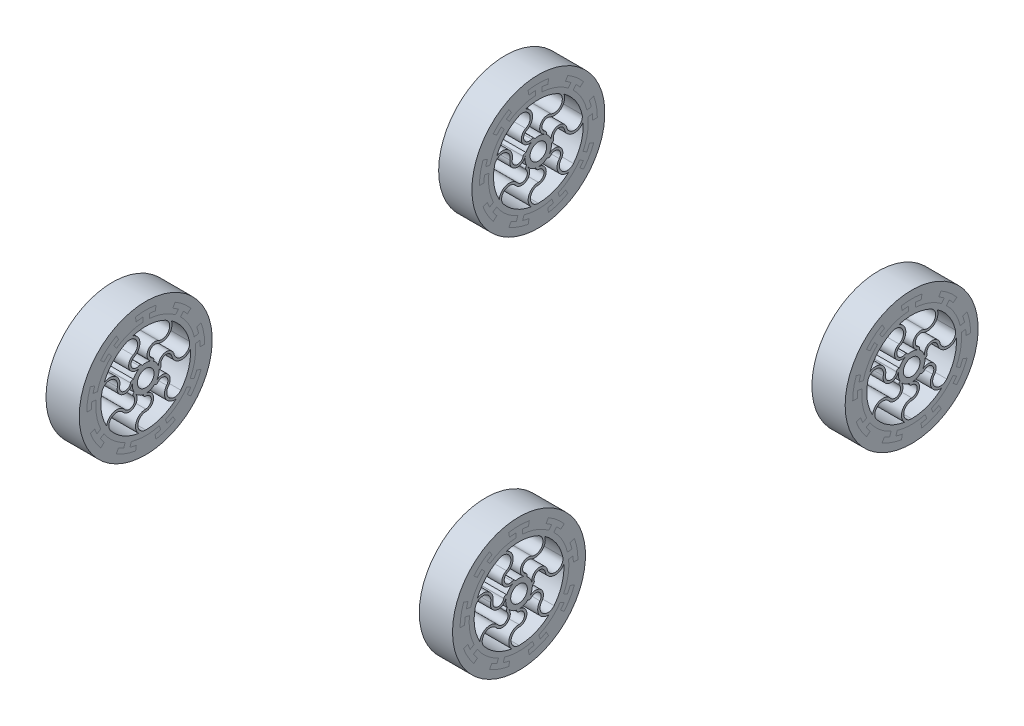
from build123d import *

# Parameters (mm, degrees)
SKETCH1_R             = 19.05
SKETCH1_R_2           = 17.145
BOSS_EXTRUDE1_DEPTH   = 12.7
SKETCH1_R_3           = 5.08
SKETCH1_R_4           = 3.175
BOSS_EXTRUDE1_2_DEPTH = 12.7
BOSS_EXTRUDE2_DEPTH   = 12.7
CIRPATTERN1_COUNT     = 7
BOSS_EXTRUDE3_DEPTH   = 12.7
CIRPATTERN2_COUNT     = 9
SKETCH5_R             = 25.4
BOSS_EXTRUDE4_DEPTH   = 12.7
LPATTERN1_COUNT       = 2
LPATTERN1_PITCH       = 149.999998656


with BuildPart() as part:
    # Sketch1 → Boss-Extrude1 (new body)
    with BuildSketch(Plane(origin=(64.949999952, 0, 0), x_dir=(0, 0, -1), z_dir=(1, 0, 0))):
        Circle(SKETCH1_R)
        Circle(SKETCH1_R_2, mode=Mode.SUBTRACT)
    extrude(amount=BOSS_EXTRUDE1_DEPTH)



with BuildPart() as body_2:
    # Sketch1 → Boss-Extrude1 2 (new body)
    with BuildSketch(Plane(origin=(64.949999952, 0, 0), x_dir=(0, 0, -1), z_dir=(1, 0, 0))):
        Circle(SKETCH1_R_3)
        Circle(SKETCH1_R_4, mode=Mode.SUBTRACT)
    extrude(amount=BOSS_EXTRUDE1_2_DEPTH)


with BuildPart() as part_1:
    add(part.part)

    add(body_2.part)  # Boss-Extrude2 merges body 2
    # Sketch2 → Boss-Extrude2 (add)
    with BuildSketch(Plane(origin=(64.949999952, 0, 0), x_dir=(0, 0, -1), z_dir=(1, 0, 0))):
        with BuildLine():
            ThreePointArc((0, -5.08), (-0.4445, -5.060515759), (-0.885590258, -5.0022125))
            ThreePointArc((-0.885590258, -5.0022125), (-0.65554332, -5.680486433), (0, -5.969))
            ThreePointArc((0, -5.969), (2.12725, -8.09625), (0, -10.2235))
            ThreePointArc((0, -10.2235), (-3.617996679, -12.658689596), (-2.723858222, -16.927244944))
            ThreePointArc((-2.723858222, -16.927244944), (-1.366274211, -17.090474534), (0, -17.145))
            ThreePointArc((0, -17.145), (-3.01625, -14.12875), (0, -11.1125))
            ThreePointArc((0, -11.1125), (3.01625, -8.09625), (0, -5.08))
        make_face()
    boss_extrude2 = extrude(amount=BOSS_EXTRUDE2_DEPTH)

    # CirPattern1: Boss-Extrude2 ×7 about axis
    cirpattern1_axis = Axis((0, 0, 0), (1, 0, 0))
    for i in range(1, CIRPATTERN1_COUNT):
        add(boss_extrude2.rotate(cirpattern1_axis, i * 360 / CIRPATTERN1_COUNT))

    # Sketch3 → Boss-Extrude3 (add)
    with BuildSketch(Plane(origin=(64.949999952, 0, 0), x_dir=(0, 0, -1), z_dir=(1, 0, 0))):
        with BuildLine():
            ThreePointArc((3.944921068, 22.17126572), (0, 22.519489911), (-3.944921068, 22.17126572))
            Line((-3.944921068, 22.17126572), (-3.633454436, 20.420759354))
            ThreePointArc((-3.633454436, 20.420759354), (-2.37627525, 20.604919793), (-1.110178794, 20.711757694))
            Line((-1.110178794, 20.711757694), (-1.110178794, 19.017623486))
            ThreePointArc((-1.110178794, 19.017623486), (0.160177578, 19.04932658), (1.429821206, 18.99626572))
            Line((1.429821206, 18.99626572), (1.429821206, 20.692148633))
            ThreePointArc((1.429821206, 20.692148633), (2.535271798, 20.585961252), (3.633454436, 20.420759354))
            Line((3.633454436, 20.420759354), (3.944921068, 22.17126572))
        make_face()
    boss_extrude3 = extrude(amount=BOSS_EXTRUDE3_DEPTH)

    # CirPattern2: Boss-Extrude3 ×9 about axis
    cirpattern2_axis = Axis((0, 0, 0), (1, 0, 0))
    for i in range(1, CIRPATTERN2_COUNT):
        add(boss_extrude3.rotate(cirpattern2_axis, i * 360 / CIRPATTERN2_COUNT))


with BuildPart() as body_2_2:
    # Sketch5 → Boss-Extrude4 (new body)
    with BuildSketch(Plane(origin=(64.949999952, 0, 0), x_dir=(0, 0, -1), z_dir=(1, 0, 0))):
        with Locations(Location((0, 0, 0), (0, 0, 180))):
            Circle(SKETCH5_R)
        with BuildLine():
            Line((-1.110178794, 20.711757694), (-1.110178794, 19.017623486))
            ThreePointArc((-1.110178794, 19.017623486), (-6.364735719, 17.955295576), (-11.115257646, 15.47105515))
            Line((-11.115257646, 15.47105515), (-12.20535017, 16.770176832))
            ThreePointArc((-12.20535017, 16.770176832), (-11.290269953, 17.399402522), (-10.342823513, 17.97874872))
            Line((-10.342823513, 17.97874872), (-11.229430034, 19.519921285))
            ThreePointArc((-11.229430034, 19.519921285), (-14.475249092, 17.250930109), (-17.273399758, 14.448428519))
            Line((-17.273399758, 14.448428519), (-15.909598674, 13.307669736))
            ThreePointArc((-15.909598674, 13.307669736), (-15.064919592, 14.25684402), (-14.163707517, 15.152517716))
            Line((-14.163707517, 15.152517716), (-13.074739039, 13.854735619))
            ThreePointArc((-13.074739039, 13.854735619), (-16.417111954, 9.663381141), (-18.459383913, 4.706765934))
            Line((-18.459383913, 4.706765934), (-20.129502554, 5.001252911))
            ThreePointArc((-20.129502554, 5.001252911), (-19.832968916, 6.07146998), (-19.479579393, 7.124281748))
            Line((-19.479579393, 7.124281748), (-21.149406021, 7.734988741))
            ThreePointArc((-21.149406021, 7.734988741), (-22.177368259, 3.910468385), (-22.51946273, -0.034988963))
            Line((-22.51946273, -0.034988963), (-20.741464876, -0.032226451))
            ThreePointArc((-20.741464876, -0.032226451), (-20.704520629, 1.237832483), (-20.58988008, 2.503246296))
            Line((-20.58988008, 2.503246296), (-18.921483577, 2.209062978))
            ThreePointArc((-18.921483577, 2.209062978), (-18.78773905, -3.150136726), (-17.166159294, -8.259871373))
            Line((-17.166159294, -8.259871373), (-18.634836978, -9.10781283))
            ThreePointArc((-18.634836978, -9.10781283), (-19.095601305, -8.097370843), (-19.501623584, -7.063715832))
            Line((-19.501623584, -7.063715832), (-21.173339882, -7.669231))
            ThreePointArc((-21.173339882, -7.669231), (-19.502450344, -11.259744956), (-17.228418814, -14.502034721))
            Line((-17.228418814, -14.502034721), (-15.868169147, -13.357043523))
            ThreePointArc((-15.868169147, -13.357043523), (-16.656246359, -12.36037463), (-17.381818923, -11.317321886))
            Line((-17.381818923, -11.317321886), (-15.914655661, -10.470254781))
            ThreePointArc((-15.914655661, -10.470254781), (-12.367374242, -14.489670609), (-7.84069796, -17.361623066))
            Line((-7.84069796, -17.361623066), (-8.420724077, -18.955231725))
            ThreePointArc((-8.420724077, -18.955231725), (-9.423189619, -18.477361856), (-10.398641363, -17.946522269))
            Line((-10.398641363, -17.946522269), (-11.290032696, -19.484932322))
            ThreePointArc((-11.290032696, -19.484932322), (-7.702119167, -21.161398494), (-3.876006263, -22.18341726))
            Line((-3.876006263, -22.18341726), (-3.569980719, -20.431951483))
            ThreePointArc((-3.569980719, -20.431951483), (-4.814329303, -20.175025083), (-6.040611514, -19.842389379))
            Line((-6.040611514, -19.842389379), (-5.46118349, -18.250423965))
            ThreePointArc((-5.46118349, -18.250423965), (-0.160177578, -19.04932658), (5.153513088, -18.339678374))
            Line((5.153513088, -18.339678374), (5.733539205, -19.933287033))
            ThreePointArc((5.733539205, -19.933287033), (4.658437217, -20.211589904), (3.569980719, -20.431951483))
            Line((3.569980719, -20.431951483), (3.876006263, -22.18341726))
            ThreePointArc((3.876006263, -22.18341726), (7.702119167, -21.161398494), (11.290032696, -19.484932322))
            Line((11.290032696, -19.484932322), (10.398641363, -17.946522269))
            ThreePointArc((10.398641363, -17.946522269), (9.280265939, -18.54955708), (8.127065156, -19.082982359))
            Line((8.127065156, -19.082982359), (7.547637131, -17.491016944))
            ThreePointArc((7.547637131, -17.491016944), (12.121967955, -14.695590934), (15.736338088, -10.736394347))
            Line((15.736338088, -10.736394347), (17.205015773, -11.584335804))
            ThreePointArc((17.205015773, -11.584335804), (16.560329506, -12.488590409), (15.868169147, -13.357043523))
            Line((15.868169147, -13.357043523), (17.228418814, -14.502034721))
            ThreePointArc((17.228418814, -14.502034721), (19.502450344, -11.259744956), (21.173339882, -7.669231))
            Line((21.173339882, -7.669231), (19.501623584, -7.063715832))
            ThreePointArc((19.501623584, -7.063715832), (19.032521609, -8.244545163), (18.491997718, -9.394435809))
            Line((18.491997718, -9.394435809), (17.024834455, -8.547368704))
            ThreePointArc((17.024834455, -8.547368704), (18.732109961, -3.465624967), (18.955955606, 1.890567916))
            Line((18.955955606, 1.890567916), (20.626074247, 2.185054893))
            ThreePointArc((20.626074247, 2.185054893), (20.713459572, 1.077959334), (20.741464876, -0.032226451))
            Line((20.741464876, -0.032226451), (22.51946273, -0.034988963))
            ThreePointArc((22.51946273, -0.034988963), (22.177368259, 3.910468385), (21.149406021, 7.734988741))
            Line((21.149406021, 7.734988741), (19.479579393, 7.124281748))
            ThreePointArc((19.479579393, 7.124281748), (19.879248896, 5.918181063), (20.204319031, 4.689871664))
            Line((20.204319031, 4.689871664), (18.535922528, 4.395688346))
            ThreePointArc((18.535922528, 4.395688346), (16.577289532, 9.385945439), (13.305870825, 13.63291244))
            Line((13.305870825, 13.63291244), (14.395963349, 14.932034122))
            ThreePointArc((14.395963349, 14.932034122), (15.174531699, 14.140119924), (15.909598674, 13.307669736))
            Line((15.909598674, 13.307669736), (17.273399758, 14.448428519))
            ThreePointArc((17.273399758, 14.448428519), (14.475249092, 17.250930109), (11.229430034, 19.519921285))
            Line((11.229430034, 19.519921285), (10.342823513, 17.97874872))
            ThreePointArc((10.342823513, 17.97874872), (11.424254691, 17.311724597), (12.462814925, 16.579736063))
            Line((12.462814925, 16.579736063), (11.373846446, 15.281953966))
            ThreePointArc((11.373846446, 15.281953966), (6.665771095, 17.84572766), (1.429821206, 18.99626572))
            Line((1.429821206, 18.99626572), (1.429821206, 20.692148633))
            ThreePointArc((1.429821206, 20.692148633), (2.535271798, 20.585961252), (3.633454436, 20.420759354))
            Line((3.633454436, 20.420759354), (3.944921068, 22.17126572))
            ThreePointArc((3.944921068, 22.17126572), (0, 22.519489911), (-3.944921068, 22.17126572))
            Line((-3.944921068, 22.17126572), (-3.633454436, 20.420759354))
            ThreePointArc((-3.633454436, 20.420759354), (-2.37627525, 20.604919793), (-1.110178794, 20.711757694))
        make_face(mode=Mode.SUBTRACT)
    extrude(amount=BOSS_EXTRUDE4_DEPTH)


with BuildPart() as lpattern1_1:
    # LPattern1: pattern copy
    add(body_2_2.part.moved(Location(Vector(0, 0, 1) * (1 * LPATTERN1_PITCH))))


with BuildPart() as lpattern1_2:
    # LPattern1: pattern copy
    add(part_1.part.moved(Location(Vector(0, 0, 1) * (1 * LPATTERN1_PITCH))))


with BuildPart() as body_5:
    # Mirror1: mirrored copy
    add(part_1.part.mirror(Plane(origin=(0, 0, 0), x_dir=(0, 0, 1), z_dir=(1, 0, 0))))


with BuildPart() as body_6:
    # Mirror1 2: mirrored copy
    add(lpattern1_2.part.mirror(Plane(origin=(0, 0, 0), x_dir=(0, 0, 1), z_dir=(1, 0, 0))))


with BuildPart() as body_7:
    # Mirror1 3: mirrored copy
    add(lpattern1_1.part.mirror(Plane(origin=(0, 0, 0), x_dir=(0, 0, 1), z_dir=(1, 0, 0))))


with BuildPart() as body_8:
    # Mirror1 4: mirrored copy
    add(body_2_2.part.mirror(Plane(origin=(0, 0, 0), x_dir=(0, 0, 1), z_dir=(1, 0, 0))))


solid = Compound([part_1.part, body_2_2.part, lpattern1_1.part, lpattern1_2.part, body_5.part, body_6.part, body_7.part, body_8.part])
